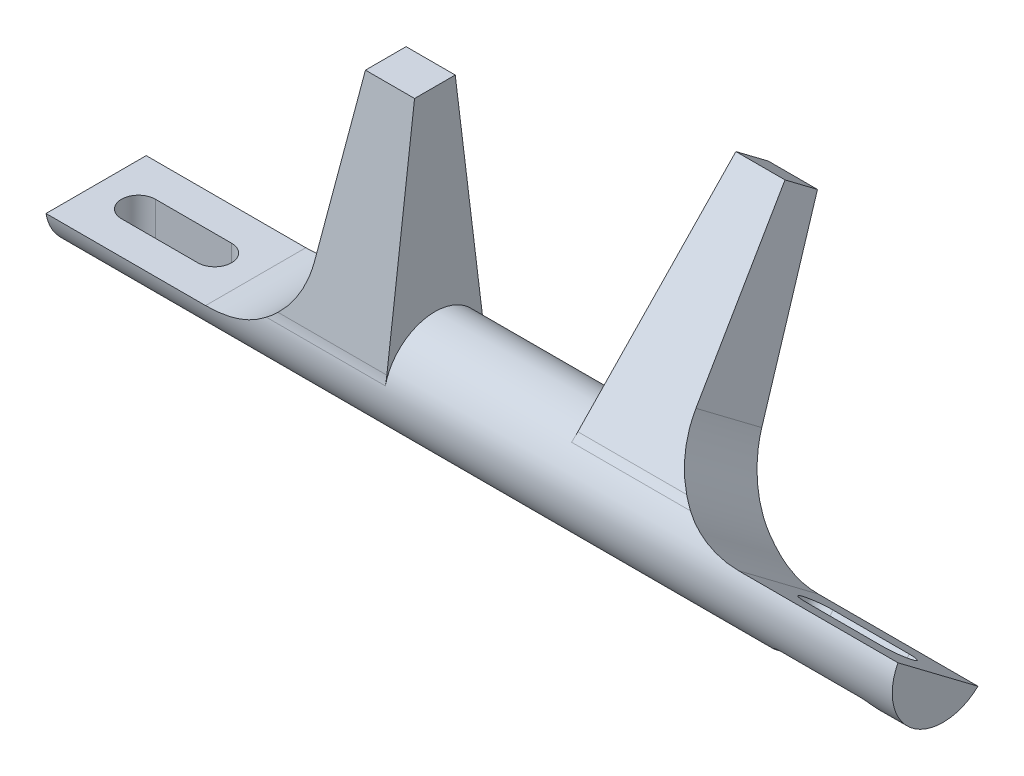
from build123d import *
from build123d.topology import SkipClean

# Parameters (mm, degrees)
SKETCH_1_R               = 30
EXTRUDE_1_DEPTH          = 250
EXTRUDE_START            = -50
EXTRUDE_2_DEPTH          = 200
CUT_EXTRUDE_2_DEPTH      = 291.559804515
CUT_EXTRUDE_2_DEPTH_BACK = 291.559804515
CUT_EXTRUDE_3_DEPTH      = 294.087017894
MOVE_BODY_1_ANGLE        = 37


with BuildPart() as part:
    # 草图1 → 凸台-拉伸1 (new body)
    with BuildSketch(Plane(origin=(0, 0, 0), x_dir=(0, 0, -1), z_dir=(1, 0, 0))):
        Circle(SKETCH_1_R)
    extrude(amount=-EXTRUDE_1_DEPTH)

    # 草图2 → 凸台-拉伸2 (add)
    with BuildSketch(Plane(origin=(0, 0, 0), x_dir=(0, 0, -1), z_dir=(1, 0, 0)).offset(EXTRUDE_START)):
        with BuildLine():
            Line((0, 30), (0, 145))
            Line((0, 145), (-12, 145))
            Line((-12, 145), (-28.365300012, 11.715327307))
            ThreePointArc((-28.365300012, 11.715327307), (-28.741827709, 9.185530552), (-29.247227848, 6.678297929))
            ThreePointArc((-29.247227848, 6.678297929), (-18.703623474, 23.455798194), (0, 30))
        make_face()
        with BuildLine():
            Line((12, 145), (0, 145))
            Line((0, 145), (0, 30))
            ThreePointArc((0, 30), (18.703623474, 23.455798194), (29.247227848, 6.678297929))
            ThreePointArc((29.247227848, 6.678297929), (28.741827709, 9.185530552), (28.365300012, 11.715327307))
            Line((28.365300012, 11.715327307), (12, 145))
        make_face()
    extrude(amount=-EXTRUDE_2_DEPTH)

    # 草图3 → 切除-拉伸2 (cut, two sides: drawn at the far end of the back side and taken through both)
    with BuildSketch(Plane.XY.offset(-CUT_EXTRUDE_2_DEPTH_BACK)):
        with BuildLine():
            Line((23.989898837, 729.084740879), (-79, 145))
            Line((-79, 145), (-96.706559796, 44.58110934))
            ThreePointArc((-96.706559796, 44.58110934), (-117.227768396, 9.037333413), (-155.795024977, -5))
            Line((-155.795024977, -5), (-250, -5))
            Line((-250, -5), (-843.095189485, -5))
            Line((-843.095189485, -5), (-1609.547408624, 900.31685665))
            Line((-1609.547408624, 900.31685665), (-742.462320303, 1634.401597529))
            Line((-742.462320303, 1634.401597529), (23.989898837, 729.084740879))
        make_face()
    extrude(amount=CUT_EXTRUDE_2_DEPTH + CUT_EXTRUDE_2_DEPTH_BACK, mode=Mode.SUBTRACT)

    # 草图4 → 切除-拉伸3 (cut, through all)
    with BuildSketch(Plane(origin=(0, -5, 0), x_dir=(1, 0, 0), z_dir=(0, 1, 0))):
        with BuildLine():
            Line((-225, 10), (-180, 10))
            ThreePointArc((-180, 10), (-170, 0), (-180, -10))
            Line((-180, -10), (-225, -10))
            ThreePointArc((-225, -10), (-235, 0), (-225, 10))
        make_face()
    extrude(amount=-CUT_EXTRUDE_3_DEPTH, mode=Mode.SUBTRACT)


with BuildPart() as body_2:
    # 镜向1: mirrored copy
    add(part.part.mirror(Plane(origin=(0, 0, 0), x_dir=(0, 0, 1), z_dir=(1, 0, 0))))


with BuildPart() as body_2_1:
    # Move Body 1: moved
    add(body_2.part.rotate(Axis((0, 0, 0), (-1, 0, 0)), MOVE_BODY_1_ANGLE))


with BuildPart() as part_1:
    add(part.part)

    # Combine 1: union body 2
    add(body_2_1.part)


solid = part_1.part
